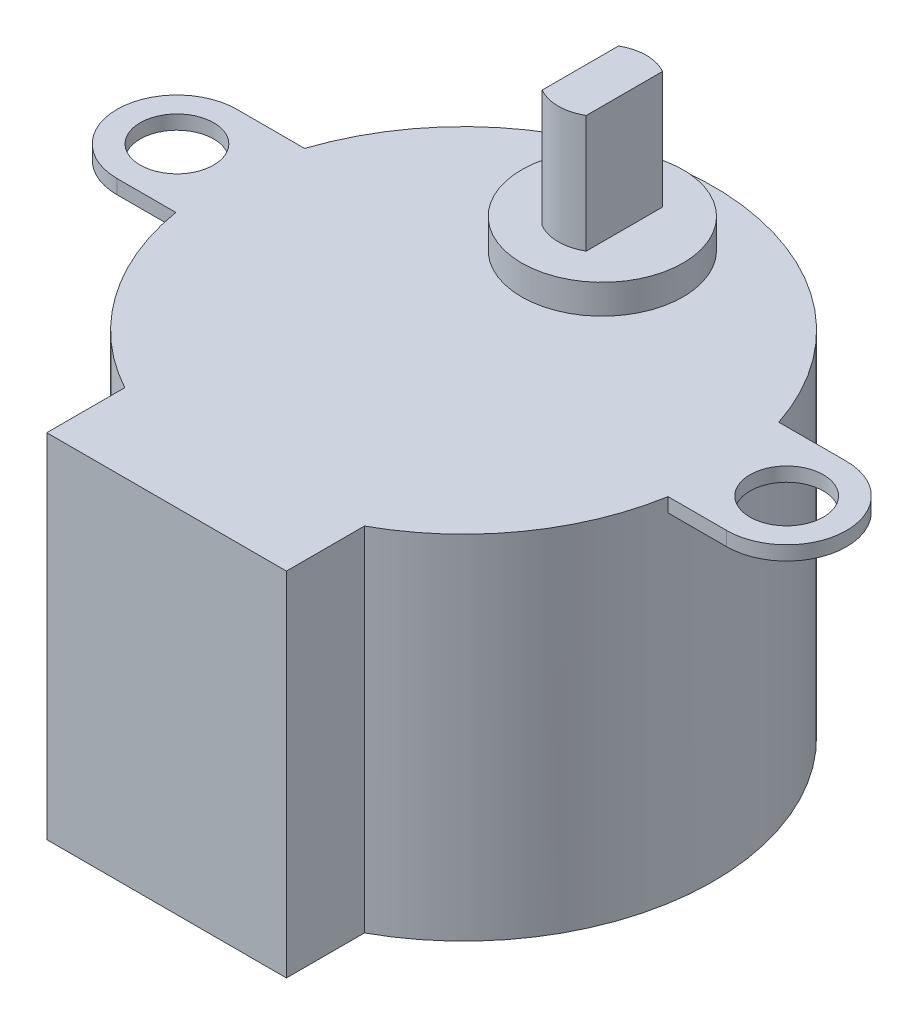
from build123d import *

# Parameters (mm, degrees)
BOSS_EXTRUDE1_DEPTH = 19.05
BOSS_EXTRUDE2_START = -0.762
SKETCH3_R           = 1.984375
BOSS_EXTRUDE2_DEPTH = 0.762
SKETCH5_R           = 4.365625
BOSS_EXTRUDE3_DEPTH = 1.5875
BOSS_EXTRUDE4_DEPTH = 6.35


with BuildPart() as part:
    # Sketch2 → Boss-Extrude1 (new body)
    with BuildSketch(Plane(origin=(0, 0, 0), x_dir=(1, 0, 0), z_dir=(0, 1, 0))):
        with BuildLine():
            Line((6.477, -16.053488894), (6.477, -11.83764166))
            ThreePointArc((6.477, -11.83764166), (0, 13.49375), (-6.477, -11.83764166))
            Line((-6.477, -11.83764166), (-6.477, -16.053488894))
            Line((-6.477, -16.053488894), (6.477, -16.053488894))
        make_face()
    extrude(amount=BOSS_EXTRUDE1_DEPTH)

    # Sketch3 → Boss-Extrude2 (add)
    # profile 1 of 2: a face of its own
    with BuildSketch(Plane(origin=(0, 19.05, 0), x_dir=(1, 0, 0), z_dir=(0, 1, 0)).offset(BOSS_EXTRUDE2_START)):
        with BuildLine():
            ThreePointArc((-16.479121392, 4.22275), (-19.717621392, 0.98425), (-16.479121392, -2.25425))
            Line((-16.479121392, -2.25425), (-13.304121392, -2.25425))
            ThreePointArc((-13.304121392, -2.25425), (-13.455592652, 1.014058895), (-12.815992802, 4.22275))
            Line((-12.815992802, 4.22275), (-16.479121392, 4.22275))
        make_face()
        with Locations(Location((-16.479121392, 0.98425, 0), (0, 0, 270))):
            Circle(SKETCH3_R, mode=Mode.SUBTRACT)
    # profile 2 of 2: a face of its own
    with BuildSketch(Plane(origin=(0, 19.05, 0), x_dir=(1, 0, 0), z_dir=(0, 1, 0)).offset(BOSS_EXTRUDE2_START)):
        with BuildLine():
            Line((16.479121392, 4.22275), (12.815992802, 4.22275))
            ThreePointArc((12.815992802, 4.22275), (13.455592652, 1.014058895), (13.304121392, -2.25425))
            Line((13.304121392, -2.25425), (16.479121392, -2.25425))
            ThreePointArc((16.479121392, -2.25425), (19.717621392, 0.98425), (16.479121392, 4.22275))
        make_face()
        with Locations(Location((16.479121392, 0.98425, 0), (0, 0, 270))):
            Circle(SKETCH3_R, mode=Mode.SUBTRACT)
    extrude(amount=BOSS_EXTRUDE2_DEPTH)

    # Sketch5 → Boss-Extrude3 (add)
    with BuildSketch(Plane(origin=(0, 19.05, 0), x_dir=(1, 0, 0), z_dir=(0, 1, 0))):
        with Locations(Location((0, 7.501133667, 0), (0, 0, 270))):
            Circle(SKETCH5_R)
    extrude(amount=BOSS_EXTRUDE3_DEPTH)

    # Sketch6 → Boss-Extrude4 (add)
    with BuildSketch(Plane(origin=(0, 20.6375, 0), x_dir=(1, 0, 0), z_dir=(0, 1, 0))):
        with BuildLine():
            ThreePointArc((1.190625, 9.56335666), (0, 9.882383667), (-1.190625, 9.56335666))
            Line((-1.190625, 9.56335666), (-1.190625, 5.438910675))
            ThreePointArc((-1.190625, 5.438910675), (0, 5.119883667), (1.190625, 5.438910675))
            Line((1.190625, 5.438910675), (1.190625, 9.56335666))
        make_face()
    extrude(amount=BOSS_EXTRUDE4_DEPTH)


solid = part.part
